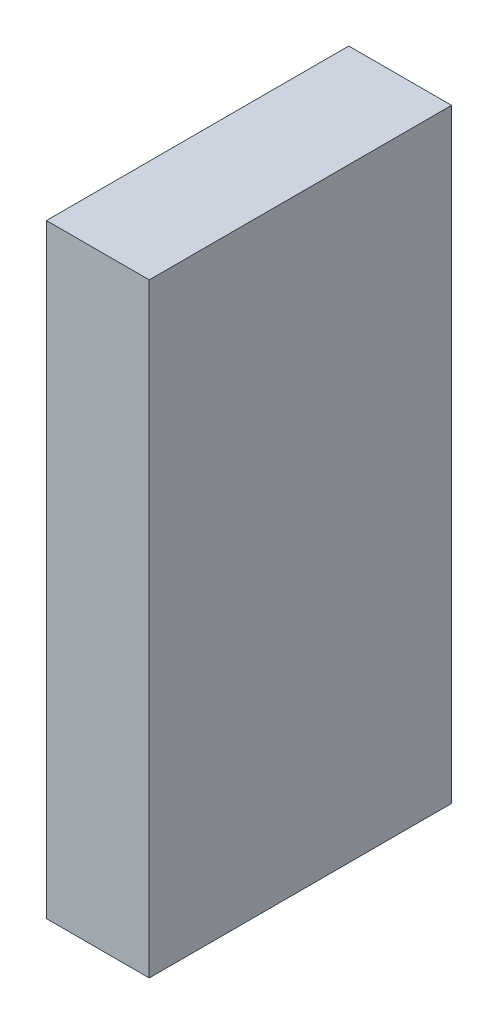
from build123d import *

# Parameters (mm, degrees)
SKETCH1_W           = 17
SKETCH1_H           = 50
BOSS_EXTRUDE1_DEPTH = 100


with BuildPart() as part:
    # Sketch1 → Boss-Extrude1 (new body)
    with BuildSketch(Plane(origin=(0, 0, 0), x_dir=(1, 0, 0), z_dir=(0, 1, 0))):
        with Locations((-84.737623762, -3.094059406)):
            Rectangle(SKETCH1_W, SKETCH1_H)
    extrude(amount=BOSS_EXTRUDE1_DEPTH)


solid = part.part
